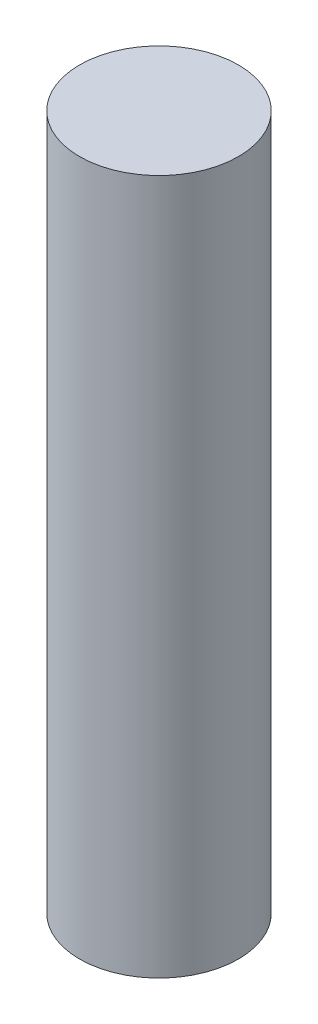
from build123d import *

# Parameters (mm, degrees)
SKETCH1_R           = 101.6
BOSS_EXTRUDE1_DEPTH = 889


with BuildPart() as part:
    # Sketch1 → Boss-Extrude1 (new body)
    with BuildSketch(Plane(origin=(0, 0, 0), x_dir=(1, 0, 0), z_dir=(0, 1, 0))):
        with Locations(Location((0, 0, 0), (0, 0, 270))):
            Circle(SKETCH1_R)
    extrude(amount=BOSS_EXTRUDE1_DEPTH)


solid = part.part
